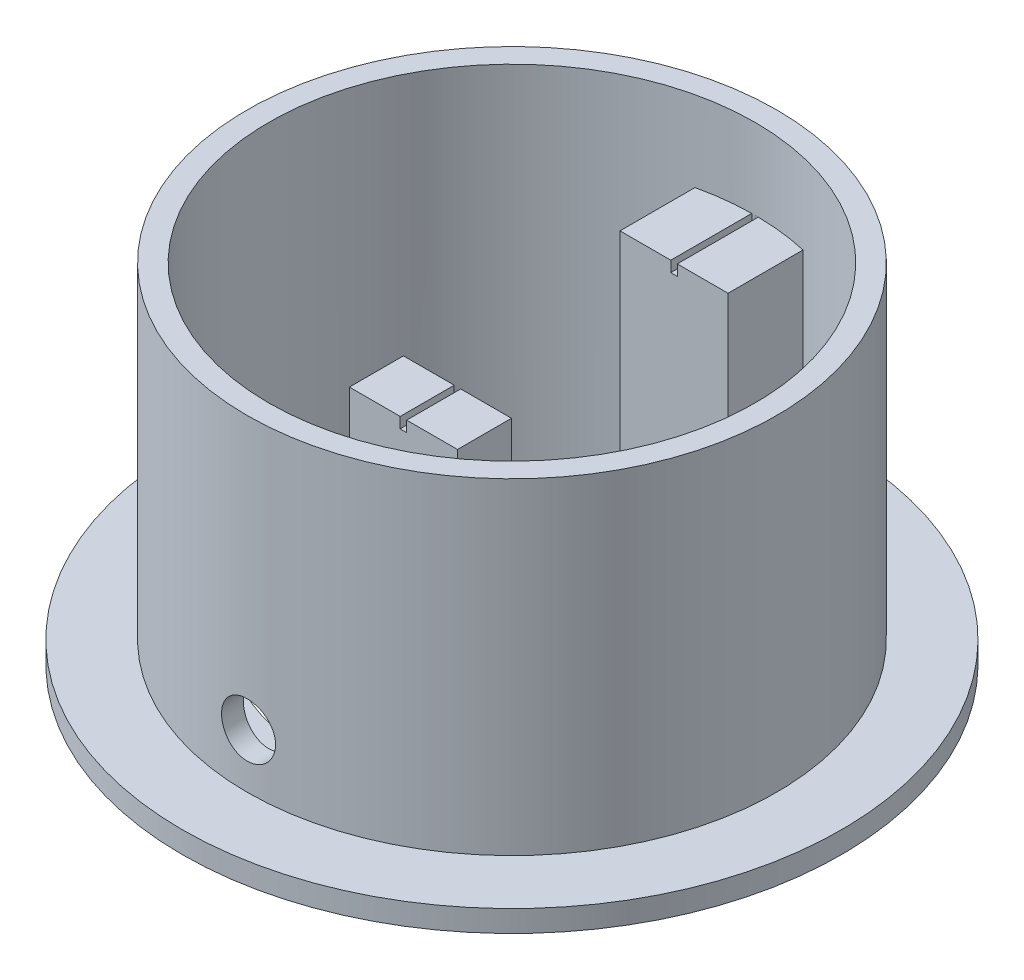
from build123d import *
from build123d.topology import SkipClean

# Parameters (mm, degrees)
SKETCH1_R           = 61
SKETCH1_R_2         = 49
BOSS_EXTRUDE1_DEPTH = 4
BOSS_EXTRUDE2_DEPTH = 4
SKETCH1_5_R         = 49
BOSS_EXTRUDE3_DEPTH = 64.4
SKETCH1_8_W         = 20
SKETCH1_8_H         = 10
BOSS_EXTRUDE4_DEPTH = 49.5
CUT_EXTRUDE1_REACH  = 115.669
SKETCH2_W           = 10
SKETCH2_H           = 24
CUT_EXTRUDE2_REACH  = 115.669
SKETCH3_R           = 5
CUT_EXTRUDE4_START  = -2
CUT_EXTRUDE4_DEPTH  = 2
SKETCH5_W           = 1.2
SKETCH5_H           = 10
CUT_EXTRUDE5_DEPTH  = 2


with BuildPart() as part:
    # Sketch1 → Boss-Extrude1 (new body)
    with BuildSketch(Plane(origin=(0, 0, 0), x_dir=(1, 0, 0), z_dir=(0, 1, 0))):
        Circle(SKETCH1_R)
        Circle(SKETCH1_R_2, mode=Mode.SUBTRACT)
    extrude(amount=BOSS_EXTRUDE1_DEPTH)



with BuildPart() as body_2:
    # Sketch1<4> → Boss-Extrude2 (new body)
    with BuildSketch(Plane(origin=(0, 0, 0), x_dir=(1, 0, 0), z_dir=(0, 1, 0))):
        with BuildLine():
            Line((31.692781496, -31.946323748), (10, -10.08))
            Line((10, -10.08), (10, -20.08))
            Line((10, -20.08), (-10, -20.08))
            Line((-10, -20.08), (-10, -10.08))
            Line((-10, -10.08), (-31.692781496, -31.946323748))
            ThreePointArc((-31.692781496, -31.946323748), (0, -45), (31.692781496, -31.946323748))
        make_face()
        with BuildLine():
            Line((-21.677506364, -29.984758092), (-15, -23.253831677))
            Line((-15, -23.253831677), (15, -23.253831677))
            Line((15, -23.253831677), (21.677506364, -29.984758092))
            ThreePointArc((21.677506364, -29.984758092), (0, -37), (-21.677506364, -29.984758092))
        make_face(mode=Mode.SUBTRACT)
    extrude(amount=BOSS_EXTRUDE2_DEPTH)


with BuildPart() as part_1:
    add(part.part)

    add(body_2.part)  # Boss-Extrude3 merges body 2
    # Sketch1<5> → Boss-Extrude3 (add)
    with BuildSketch(Plane(origin=(0, 0, 0), x_dir=(1, 0, 0), z_dir=(0, 1, 0))):
        Circle(SKETCH1_5_R)
        with BuildLine():
            ThreePointArc((45, 0), (41.540192388, -17.303537683), (31.692781496, -31.946323748))
            ThreePointArc((31.692781496, -31.946323748), (0, -45), (-31.692781496, -31.946323748))
            ThreePointArc((-31.692781496, -31.946323748), (-43.264113772, 12.378063642), (-10, 43.874821937))
            ThreePointArc((-10, 43.874821937), (0, 45), (10, 43.874821937))
            ThreePointArc((10, 43.874821937), (35.178118199, 28.062430401), (45, 0))
        make_face(mode=Mode.SUBTRACT)
    extrude(amount=BOSS_EXTRUDE3_DEPTH)

    # Sketch1<8> → Boss-Extrude4 (add)
    with BuildSketch(Plane(origin=(0, 0, 0), x_dir=(1, 0, 0), z_dir=(0, 1, 0))):
        with BuildLine():
            Line((-10, 30), (0, 30))
            Line((0, 30), (10, 30))
            Line((10, 30), (10, 43.874821937))
            ThreePointArc((10, 43.874821937), (0, 45), (-10, 43.874821937))
            Line((-10, 43.874821937), (-10, 30))
        make_face()
        with Locations((0, -15.08)):
            Rectangle(SKETCH1_8_W, SKETCH1_8_H)
    extrude(amount=BOSS_EXTRUDE4_DEPTH)

    # Sketch2 → Cut-Extrude1 (cut, up to next)
    with BuildSketch(Plane(origin=(0, 0, 10.08), x_dir=(-1, 0, 0), z_dir=(0, 0, -1)), mode=Mode.PRIVATE) as cut_extrude1_sk1:
        with Locations((0, 17)):
            Rectangle(SKETCH2_W, SKETCH2_H)
    cut_extrude1_tool1 = extrude(cut_extrude1_sk1.sketch, amount=-CUT_EXTRUDE1_REACH, mode=Mode.PRIVATE) & part_1.part
    add(cut_extrude1_tool1.solids().sort_by_distance((0, 17, 10.08))[0], mode=Mode.SUBTRACT)

    # Sketch3 → Cut-Extrude2 (cut, up to next)
    with BuildSketch(Plane(origin=(0, 0, 10.08), x_dir=(-1, 0, 0), z_dir=(0, 0, -1)), mode=Mode.PRIVATE) as cut_extrude2_sk1:
        with Locations((0, 14)):
            Circle(SKETCH3_R)
    cut_extrude2_tool1 = extrude(cut_extrude2_sk1.sketch, amount=-CUT_EXTRUDE2_REACH, mode=Mode.PRIVATE) & part_1.part
    add(cut_extrude2_tool1.solids().sort_by_distance((0, 14, 10.08))[0], mode=Mode.SUBTRACT)

    # Sketch4 → Cut-Extrude4 (cut)
    with SkipClean():  # the faces are left unmerged after this step: merging them gives an invalid solid
        with BuildSketch(Plane(origin=(0, 49.5, 0), x_dir=(1, 0, 0), z_dir=(0, 1, 0)).offset(CUT_EXTRUDE4_START)):
            with BuildLine():
                Line((-0.6, 44.995999822), (-0.6, 30))
                Line((-0.6, 30), (0.6, 30))
                Line((0.6, 30), (0.6, 44.995999822))
                Line((0.6, 44.995999822), (0, 45))
                ThreePointArc((0, 45), (-0.300006667, 44.998999944), (-0.6, 44.995999822))
            make_face()
        extrude(amount=CUT_EXTRUDE4_DEPTH, mode=Mode.SUBTRACT)

    # Sketch5 → Cut-Extrude5 (cut)
    with SkipClean():  # the faces are left unmerged after this step: merging them gives an invalid solid
        with BuildSketch(Plane(origin=(0, 49.5, 0), x_dir=(1, 0, 0), z_dir=(0, 1, 0))):
            with Locations((0, -15.08)):
                Rectangle(SKETCH5_W, SKETCH5_H)
        extrude(amount=-CUT_EXTRUDE5_DEPTH, mode=Mode.SUBTRACT)


solid = part_1.part
